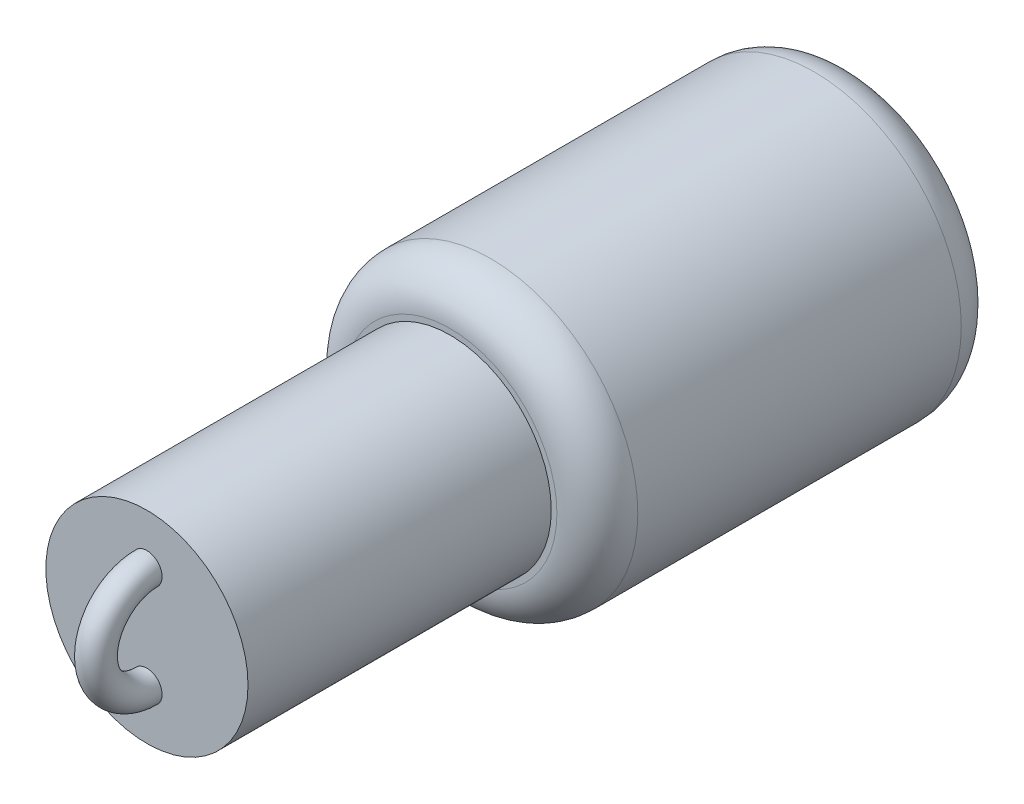
from build123d import *

# Parameters (mm, degrees)
SKETCH1_R           = 7.28
BOSS_EXTRUDE1_DEPTH = 20
FILLET1_R           = 2
SKETCH2_R           = 5
BOSS_EXTRUDE2_DEPTH = 15
SKETCH4_R           = 0.75
REVOLVE1_ANGLE      = 200


with BuildPart() as part:
    # Sketch1 → Boss-Extrude1 (new body)
    with BuildSketch(Plane.XY):
        Circle(SKETCH1_R)
    extrude(amount=BOSS_EXTRUDE1_DEPTH)

    # Fillet1
    fillet1_edges = [part.edges().sort_by_distance(p)[0] for p in [
        (-7.28, 0, 0),
        (-7.28, 0, 20),
    ]]
    fillet(fillet1_edges, radius=FILLET1_R)

    # Sketch2 → Boss-Extrude2 (add)
    with BuildSketch(Plane.XY.offset(20)):
        Circle(SKETCH2_R)
    extrude(amount=BOSS_EXTRUDE2_DEPTH)

    # Sketch4 → Revolve1 (revolve)
    with BuildSketch(Plane.XY.offset(35)):
        with Locations((0, 2.519535337)):
            Circle(SKETCH4_R)
    revolve(axis=Axis((-4.466449007, 0, 35), (1, 0, 0)), revolution_arc=REVOLVE1_ANGLE)


solid = part.part
